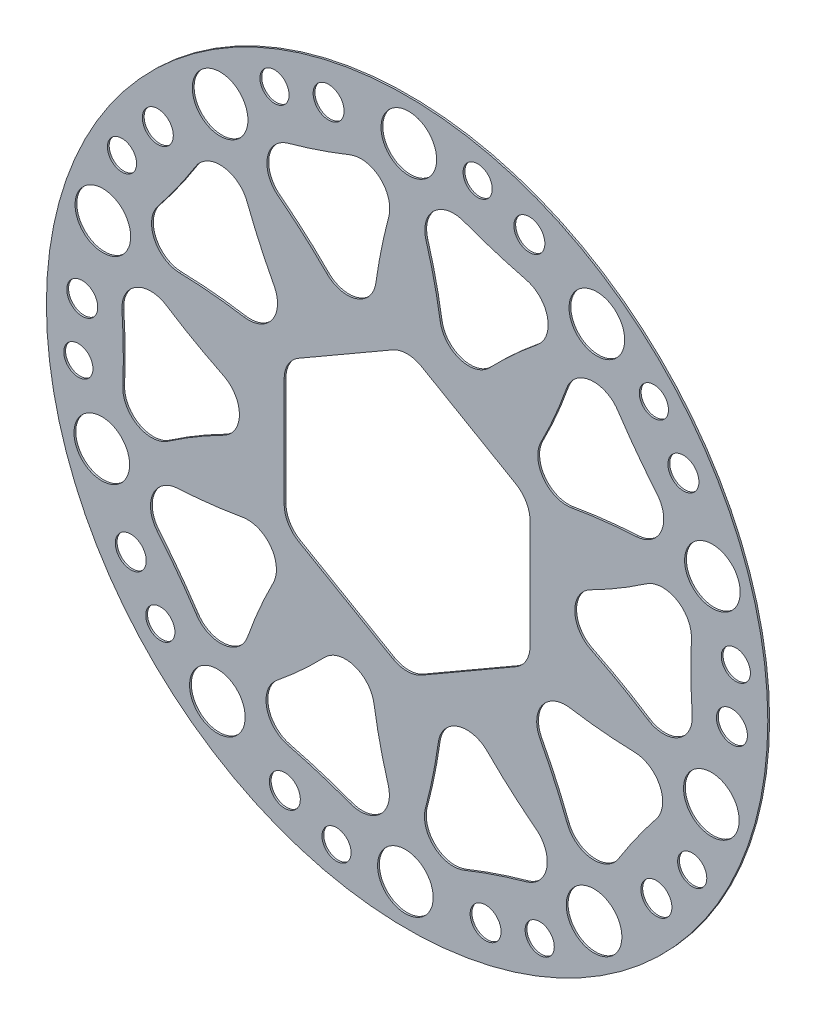
from build123d import *

# Parameters (mm, degrees)
SKETCH4_R           = 100
SKETCH4_R_2         = 7.709671905
SKETCH4_R_3         = 4.293457035
SKETCH4_R_4         = 4.043319463
BOSS_EXTRUDE3_DEPTH = 0.5


with BuildPart() as part:
    # Sketch4 → Boss-Extrude3 (new body)
    with BuildSketch(Plane.XY):
        Circle(SKETCH4_R)
        with Locations((-51.833048523, 72.153357866)):
            Circle(SKETCH4_R_2, mode=Mode.SUBTRACT)
        with Locations((0.476862532, 88.839994218)):
            Circle(SKETCH4_R_2, mode=Mode.SUBTRACT)
        with Locations((52.604628307, 71.592772339)):
            Circle(SKETCH4_R_2, mode=Mode.SUBTRACT)
        with Locations((84.639214035, 26.999544775)):
            Circle(SKETCH4_R_2, mode=Mode.SUBTRACT)
        with Locations((84.344496782, -27.906591212)):
            Circle(SKETCH4_R_2, mode=Mode.SUBTRACT)
        with Locations((51.833048523, -72.153357866)):
            Circle(SKETCH4_R_2, mode=Mode.SUBTRACT)
        with Locations((-0.476862532, -88.839994218)):
            Circle(SKETCH4_R_2, mode=Mode.SUBTRACT)
        with Locations((-52.604628307, -71.592772339)):
            Circle(SKETCH4_R_2, mode=Mode.SUBTRACT)
        with Locations((-84.639214035, -26.999544775)):
            Circle(SKETCH4_R_2, mode=Mode.SUBTRACT)
        with Locations((-84.344496782, 27.906591212)):
            Circle(SKETCH4_R_2, mode=Mode.SUBTRACT)
        with Locations((-69.108190101, 58.095232128)):
            Circle(SKETCH4_R_3, mode=Mode.SUBTRACT)
        with Locations((-79.041417756, 46.2537546)):
            Circle(SKETCH4_R_4, mode=Mode.SUBTRACT)
        with Locations((-36.758575407, 83.879453202)):
            Circle(SKETCH4_R_4, mode=Mode.SUBTRACT)
        with Locations((-21.762179569, 87.620805038)):
            Circle(SKETCH4_R_3, mode=Mode.SUBTRACT)
        with Locations((19.56479337, 89.466051639)):
            Circle(SKETCH4_R_4, mode=Mode.SUBTRACT)
        with Locations((33.89624389, 83.678208545)):
            Circle(SKETCH4_R_3, mode=Mode.SUBTRACT)
        with Locations((68.415076062, 60.879659189)):
            Circle(SKETCH4_R_4, mode=Mode.SUBTRACT)
        with Locations((76.607454273, 47.773380505)):
            Circle(SKETCH4_R_3, mode=Mode.SUBTRACT)
        with Locations((91.133125041, 9.039306152)):
            Circle(SKETCH4_R_4, mode=Mode.SUBTRACT)
        with Locations((90.057220916, -6.37925513)):
            Circle(SKETCH4_R_3, mode=Mode.SUBTRACT)
        with Locations((79.041417756, -46.2537546)):
            Circle(SKETCH4_R_4, mode=Mode.SUBTRACT)
        with Locations((69.108190101, -58.095232128)):
            Circle(SKETCH4_R_3, mode=Mode.SUBTRACT)
        with Locations((36.758575407, -83.879453202)):
            Circle(SKETCH4_R_4, mode=Mode.SUBTRACT)
        with Locations((21.762179569, -87.620805038)):
            Circle(SKETCH4_R_3, mode=Mode.SUBTRACT)
        with Locations((-19.56479337, -89.466051639)):
            Circle(SKETCH4_R_4, mode=Mode.SUBTRACT)
        with Locations((-33.89624389, -83.678208545)):
            Circle(SKETCH4_R_3, mode=Mode.SUBTRACT)
        with Locations((-68.415076062, -60.879659189)):
            Circle(SKETCH4_R_4, mode=Mode.SUBTRACT)
        with Locations((-76.607454273, -47.773380505)):
            Circle(SKETCH4_R_3, mode=Mode.SUBTRACT)
        with Locations((-91.133125041, -9.039306152)):
            Circle(SKETCH4_R_4, mode=Mode.SUBTRACT)
        with Locations((-90.057220916, 6.37925513)):
            Circle(SKETCH4_R_3, mode=Mode.SUBTRACT)
        with BuildLine():
            Line((-30.083194516, -21.987342606), (-4, -37.046481981))
            ThreePointArc((-4, -37.046481981), (0, -38.118278751), (4, -37.046481981))
            Line((4, -37.046481981), (30.083194516, -21.987342606))
            ThreePointArc((30.083194516, -21.987342606), (33.011397747, -19.059139375), (34.083194516, -15.059139375))
            Line((34.083194516, -15.059139375), (34.083194516, 15.059139375))
            ThreePointArc((34.083194516, 15.059139375), (33.011397747, 19.059139375), (30.083194516, 21.987342606))
            Line((30.083194516, 21.987342606), (4, 37.046481981))
            ThreePointArc((4, 37.046481981), (0, 38.118278751), (-4, 37.046481981))
            Line((-4, 37.046481981), (-30.083194516, 21.987342606))
            ThreePointArc((-30.083194516, 21.987342606), (-33.011397747, 19.059139375), (-34.083194516, 15.059139375))
            Line((-34.083194516, 15.059139375), (-34.083194516, -15.059139375))
            ThreePointArc((-34.083194516, -15.059139375), (-33.011397747, -19.059139375), (-30.083194516, -21.987342606))
        make_face(mode=Mode.SUBTRACT)
        with BuildLine():
            ThreePointArc((-79.041417756, 9.075699852), (-78.675414747, -0.003129792), (-78.819462746, -9.088192042))
            ThreePointArc((-78.819462746, -9.088192042), (-74.705516442, -16.436532645), (-66.293727059, -16.03099205))
            ThreePointArc((-66.293727059, -16.03099205), (-58.733632242, -11.195000294), (-50.867669858, -6.874295994))
            ThreePointArc((-50.867669858, -6.874295994), (-46.483207187, 0.324262898), (-50.978822695, 7.453933594))
            ThreePointArc((-50.978822695, 7.453933594), (-58.980049319, 11.657163363), (-66.711957636, 16.33737295))
            ThreePointArc((-66.711957636, 16.33737295), (-75.12002492, 16.515457082), (-79.041417756, 9.075699852))
        make_face(mode=Mode.SUBTRACT)
        with BuildLine():
            ThreePointArc((-58.611287696, 53.801775093), (-63.651587216, 46.241716451), (-69.108190101, 38.976415985))
            ThreePointArc((-69.108190101, 38.976415985), (-70.099183862, 30.613366591), (-63.055532517, 25.99713008))
            ThreePointArc((-63.055532517, 25.99713008), (-54.096762698, 25.465817356), (-45.193419184, 24.337843877))
            ThreePointArc((-45.193419184, 24.337843877), (-37.415107618, 27.584477859), (-36.861421675, 35.994959112))
            ThreePointArc((-36.861421675, 35.994959112), (-40.86395352, 44.098446437), (-44.368240575, 52.42951721))
            ThreePointArc((-44.368240575, 52.42951721), (-51.065834671, 57.515728249), (-58.611287696, 53.801775093))
        make_face(mode=Mode.SUBTRACT)
        with BuildLine():
            ThreePointArc((-15.793637862, 77.977400904), (-24.315016806, 74.823798708), (-32.999937739, 72.153357866))
            ThreePointArc((-32.999937739, 72.153357866), (-38.717345631, 65.970000299), (-35.732267733, 58.095232128))
            ThreePointArc((-35.732267733, 58.095232128), (-28.796768484, 52.399558327), (-22.25681845, 46.2537546))
            ThreePointArc((-22.25681845, 46.2537546), (-14.055708632, 44.308359839), (-8.664210449, 50.787133672))
            ThreePointArc((-8.664210449, 50.787133672), (-7.139216391, 59.695621822), (-5.077363635, 68.49536791))
            ThreePointArc((-5.077363635, 68.49536791), (-7.506231241, 76.546946113), (-15.793637862, 77.977400904))
        make_face(mode=Mode.SUBTRACT)
        with BuildLine():
            ThreePointArc((33.05664483, 72.368309924), (24.309063587, 74.825733026), (15.713169213, 77.770169444))
            ThreePointArc((15.713169213, 77.770169444), (7.453202677, 76.128336131), (5.23950883, 68.002930089))
            ThreePointArc((5.23950883, 68.002930089), (7.502612525, 59.318449013), (9.18113045, 50.502303173))
            ThreePointArc((9.18113045, 50.502303173), (14.672493316, 44.107954347), (22.842434682, 46.180349362))
            ThreePointArc((22.842434682, 46.180349362), (29.312458747, 52.491098651), (36.152893641, 58.39831614))
            ThreePointArc((36.152893641, 58.39831614), (38.920497396, 66.339832296), (33.05664483, 72.368309924))
        make_face(mode=Mode.SUBTRACT)
        with BuildLine():
            ThreePointArc((69.280412751, 39.116984261), (63.647907924, 46.246780561), (58.424379596, 53.681419606))
            ThreePointArc((58.424379596, 53.681419606), (50.776880887, 57.208235068), (44.209971104, 51.935820089))
            ThreePointArc((44.209971104, 51.935820089), (40.936250553, 43.579708336), (37.112199574, 35.460688444))
            ThreePointArc((37.112199574, 35.460688444), (37.796301516, 27.059809469), (45.624046151, 23.934241207))
            ThreePointArc((45.624046151, 23.934241207), (54.567770937, 25.236759902), (63.573974337, 25.99509249))
            ThreePointArc((63.573974337, 25.99509249), (70.480918886, 30.793157351), (69.280412751, 39.116984261))
        make_face(mode=Mode.SUBTRACT)
        with BuildLine():
            ThreePointArc((79.041417756, -9.075699852), (78.675414747, 0.003129792), (78.819462746, 9.088192042))
            ThreePointArc((78.819462746, 9.088192042), (74.705516442, 16.436532645), (66.293727059, 16.03099205))
            ThreePointArc((66.293727059, 16.03099205), (58.733632242, 11.195000294), (50.867669858, 6.874295994))
            ThreePointArc((50.867669858, 6.874295994), (46.483207187, -0.324262898), (50.978822695, -7.453933594))
            ThreePointArc((50.978822695, -7.453933594), (58.980049319, -11.657163363), (66.711957636, -16.33737295))
            ThreePointArc((66.711957636, -16.33737295), (75.12002492, -16.515457082), (79.041417756, -9.075699852))
        make_face(mode=Mode.SUBTRACT)
        with BuildLine():
            ThreePointArc((58.611287696, -53.801775093), (63.651587216, -46.241716451), (69.108190101, -38.976415985))
            ThreePointArc((69.108190101, -38.976415985), (70.099183862, -30.613366591), (63.055532517, -25.99713008))
            ThreePointArc((63.055532517, -25.99713008), (54.096762698, -25.465817356), (45.193419184, -24.337843877))
            ThreePointArc((45.193419184, -24.337843877), (37.415107618, -27.584477859), (36.861421675, -35.994959112))
            ThreePointArc((36.861421675, -35.994959112), (40.86395352, -44.098446437), (44.368240575, -52.42951721))
            ThreePointArc((44.368240575, -52.42951721), (51.065834671, -57.515728249), (58.611287696, -53.801775093))
        make_face(mode=Mode.SUBTRACT)
        with BuildLine():
            ThreePointArc((15.793637862, -77.977400904), (24.315016806, -74.823798708), (32.999937739, -72.153357866))
            ThreePointArc((32.999937739, -72.153357866), (38.717345631, -65.970000299), (35.732267733, -58.095232128))
            ThreePointArc((35.732267733, -58.095232128), (28.796768484, -52.399558327), (22.25681845, -46.2537546))
            ThreePointArc((22.25681845, -46.2537546), (14.055708632, -44.308359839), (8.664210449, -50.787133672))
            ThreePointArc((8.664210449, -50.787133672), (7.139216391, -59.695621822), (5.077363635, -68.49536791))
            ThreePointArc((5.077363635, -68.49536791), (7.506231241, -76.546946113), (15.793637862, -77.977400904))
        make_face(mode=Mode.SUBTRACT)
        with BuildLine():
            ThreePointArc((-33.05664483, -72.368309924), (-24.309063587, -74.825733026), (-15.713169213, -77.770169444))
            ThreePointArc((-15.713169213, -77.770169444), (-7.453202677, -76.128336131), (-5.23950883, -68.002930089))
            ThreePointArc((-5.23950883, -68.002930089), (-7.502612525, -59.318449013), (-9.18113045, -50.502303173))
            ThreePointArc((-9.18113045, -50.502303173), (-14.672493316, -44.107954347), (-22.842434682, -46.180349362))
            ThreePointArc((-22.842434682, -46.180349362), (-29.312458747, -52.491098651), (-36.152893641, -58.39831614))
            ThreePointArc((-36.152893641, -58.39831614), (-38.920497396, -66.339832296), (-33.05664483, -72.368309924))
        make_face(mode=Mode.SUBTRACT)
        with BuildLine():
            ThreePointArc((-69.280412751, -39.116984261), (-63.647907924, -46.246780561), (-58.424379596, -53.681419606))
            ThreePointArc((-58.424379596, -53.681419606), (-50.776880887, -57.208235068), (-44.209971104, -51.935820089))
            ThreePointArc((-44.209971104, -51.935820089), (-40.936250553, -43.579708336), (-37.112199574, -35.460688444))
            ThreePointArc((-37.112199574, -35.460688444), (-37.796301516, -27.059809469), (-45.624046151, -23.934241207))
            ThreePointArc((-45.624046151, -23.934241207), (-54.567770937, -25.236759902), (-63.573974337, -25.99509249))
            ThreePointArc((-63.573974337, -25.99509249), (-70.480918886, -30.793157351), (-69.280412751, -39.116984261))
        make_face(mode=Mode.SUBTRACT)
    extrude(amount=BOSS_EXTRUDE3_DEPTH)


solid = part.part
